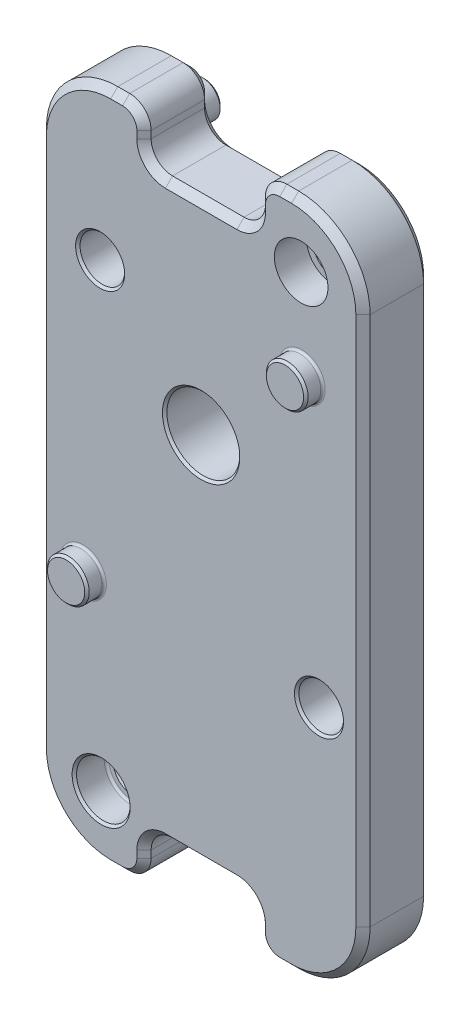
from build123d import *

# Parameters (mm, degrees)
SKETCH2_W                            = 28.7782
SKETCH2_H                            = 59.832519375
SKETCH2_R                            = 3.2385
SKETCH2_R_2                          = 1.5875
BOSS_EXTRUDE1_DEPTH                  = 6.0198
SKETCH3_R                            = 2.38125
CUT_EXTRUDE1_COUNTER_SINK_DEPTH      = 2.8448
SKETCH4_R                            = 1.5875
BOSS_EXTRUDE2_BACKPEGS_DEPTH         = 3.175
SKETCH5_R                            = 1.9812
CUT_EXTRUDE2_ENCODERSCREWHOLES_DEPTH = 42.069031354
CUT_EXTRUDE4_DEPTH                   = 2.8448
SKETCH6_R                            = 1.8542
BOSS_EXTRUDE3_ENCODERPEGS_DEPTH      = 1.524
SKETCH7_R                            = 3.96875
BOSS_EXTRUDE4_DEPTH                  = 3.175
SKETCH10_W                           = 10.16
SKETCH10_H                           = 4.445
CUT_EXTRUDE3_DEPTH                   = 41.731190846
FILLET1_0_25_R                       = 6.35
FILLET5_R                            = 1.905
FILLET4_0_075_R                      = 1.905
FILLET3_1_128_R                      = 0.1984375
CHAMFER1_0_25_SIZE                   = 0.635
CHAMFER2_1_128_SIZE                  = 0.1984375
CHAMFER3_1_64_SIZE                   = 0.396875


with BuildPart() as part:
    # Sketch2 → Boss-Extrude1 (new body)
    with BuildSketch(Plane.XY):
        with Locations((0, -7.434440313)):
            Rectangle(SKETCH2_W, SKETCH2_H)
        Circle(SKETCH2_R, mode=Mode.SUBTRACT)
        with Locations((8.89, 16.982719375)):
            Circle(SKETCH2_R_2, mode=Mode.SUBTRACT)
        with Locations((-8.89, -31.8516)):
            Circle(SKETCH2_R_2, mode=Mode.SUBTRACT)
    extrude(amount=BOSS_EXTRUDE1_DEPTH)

    # Sketch3 → Cut-Extrude1_Counter-sink (cut)
    with BuildSketch(Plane.XY.offset(6.0198)):
        with Locations((-8.89, -31.8516)):
            Circle(SKETCH3_R)
        with Locations((8.89, 16.982719375)):
            Circle(SKETCH3_R)
    extrude(amount=-CUT_EXTRUDE1_COUNTER_SINK_DEPTH, mode=Mode.SUBTRACT)

    # Sketch4 → Boss-Extrude2_BackPegs (add)
    with BuildSketch(Plane(origin=(0, 0, 0), x_dir=(-1, 0, 0), z_dir=(0, 0, -1))):
        with Locations((-8.89, -31.8516)):
            Circle(SKETCH4_R)
        with Locations((8.89, 16.982719375)):
            Circle(SKETCH4_R)
    extrude(amount=BOSS_EXTRUDE2_BACKPEGS_DEPTH)

    # Sketch5 → Cut-Extrude2_EncoderScrewHoles (cut, through all)
    with BuildSketch(Plane.XY.offset(6.0198)):
        with Locations((10.4775, -15.748)):
            Circle(SKETCH5_R)
        with Locations((-8.9789, 8.981612037)):
            Circle(SKETCH5_R)
    extrude(amount=-CUT_EXTRUDE2_ENCODERSCREWHOLES_DEPTH, mode=Mode.SUBTRACT)

    # Sketch11 → Cut-Extrude4 (cut)
    with BuildSketch(Plane(origin=(0, 0, 0), x_dir=(-1, 0, 0), z_dir=(0, 0, -1))):
        Polygon((8.9789, 5.608731765), (11.8999, 7.295171901), (11.8999, 10.668052174), (8.9789, 12.35449231), (6.0579, 10.668052174), (6.0579, 7.295171901), align=None)
        Polygon((-7.5565, -17.434440136), (-7.5565, -14.061559864), (-10.4775, -12.375119727), (-13.3985, -14.061559864), (-13.3985, -17.434440136), (-10.4775, -19.120880273), align=None)
    extrude(amount=-CUT_EXTRUDE4_DEPTH, mode=Mode.SUBTRACT)

    # Sketch6 → Boss-Extrude3_EncoderPegs (add)
    with BuildSketch(Plane.XY.offset(6.0198)):
        with Locations((-10.4775, -15.748)):
            Circle(SKETCH6_R)
        with Locations((8.9789, 8.981612037)):
            Circle(SKETCH6_R)
    extrude(amount=BOSS_EXTRUDE3_ENCODERPEGS_DEPTH)

    # Sketch7 → Boss-Extrude4 (add)
    with BuildSketch(Plane(origin=(0, 0, 0), x_dir=(-1, 0, 0), z_dir=(0, 0, -1))):
        with Locations((0, -11.9507)):
            Circle(SKETCH7_R)
    extrude(amount=BOSS_EXTRUDE4_DEPTH)

    # Sketch10 → Cut-Extrude3 (cut, through all)
    with BuildSketch(Plane(origin=(0, 0, 0), x_dir=(-1, 0, 0), z_dir=(0, 0, -1))):
        with Locations((0, 20.259319375)):
            Rectangle(SKETCH10_W, SKETCH10_H)
    cut_extrude3 = extrude(amount=-CUT_EXTRUDE3_DEPTH, mode=Mode.SUBTRACT)

    # Mirror1: Cut-Extrude3 across plane
    add(cut_extrude3.mirror(Plane(origin=(0, -7.434440312, 0), x_dir=(0, 0, 1), z_dir=(0, -1, 0))), mode=Mode.SUBTRACT)

    # Fillet1_0.25
    fillet1_0_25_edges = [part.edges().sort_by_distance(p)[0] for p in [
        (-14.3891, -37.3507, 3.0099),
        (14.3891, -37.3507, 3.0099),
        (14.3891, 22.481819375, 3.0099),
        (-14.3891, 22.481819375, 3.0099),
    ]]
    fillet(fillet1_0_25_edges, radius=FILLET1_0_25_R)

    # Fillet5
    fillet5_edges = [part.edges().sort_by_distance(p)[0] for p in [
        (-5.08, 22.481819375, 3.0099),
        (5.08, 22.481819375, 3.0099),
        (5.08, -37.3507, 3.0099),
        (-5.08, -37.3507, 3.0099),
    ]]
    fillet(fillet5_edges, radius=FILLET5_R)

    # Fillet4_0.075
    fillet4_0_075_edges = [part.edges().sort_by_distance(p)[0] for p in [
        (-5.08, 18.036819375, 3.0099),
        (5.08, 18.036819375, 3.0099),
        (-5.08, -32.9057, 3.0099),
        (5.08, -32.9057, 3.0099),
    ]]
    fillet(fillet4_0_075_edges, radius=FILLET4_0_075_R)

    # Fillet3_1/128
    fillet3_1_128_edges = [part.edges().sort_by_distance(p)[0] for p in [
        (-11.27125, -31.8516, 3.175),
        (10.4775, -31.8516, 0),
        (-7.3025, 16.982719375, 0),
        (7.1247, 8.981612037, 6.0198),
        (-12.3317, -15.748, 6.0198),
        (3.96875, -11.9507, 0),
        (13.3985, -14.061559864, 1.4224),
        (10.4775, -12.375119727, 1.4224),
        (7.5565, -14.061559864, 1.4224),
        (7.5565, -17.434440136, 1.4224),
        (10.4775, -19.120880273, 1.4224),
        (13.3985, -17.434440136, 1.4224),
        (13.3985, -15.748, 2.8448),
        (11.938, -13.218339796, 2.8448),
        (9.017, -13.218339796, 2.8448),
        (7.5565, -15.748, 2.8448),
        (9.017, -18.277660204, 2.8448),
        (11.938, -18.277660204, 2.8448),
        (-8.9789, 5.608731765, 1.4224),
        (-11.8999, 7.295171901, 1.4224),
        (-11.8999, 10.668052174, 1.4224),
        (-8.9789, 12.35449231, 1.4224),
        (-6.0579, 10.668052174, 1.4224),
        (-6.0579, 7.295171901, 1.4224),
        (-6.0579, 8.981612037, 2.8448),
        (-7.5184, 6.451951833, 2.8448),
        (-10.4394, 6.451951833, 2.8448),
        (-11.8999, 8.981612037, 2.8448),
        (-10.4394, 11.511272242, 2.8448),
        (-7.5184, 11.511272242, 2.8448),
    ]]
    fillet(fillet3_1_128_edges, radius=FILLET3_1_128_R)

    # Chamfer1_0.25
    chamfer1_0_25_edges = [part.edges().sort_by_distance(p)[0] for p in [
        (-12.529228061, -35.490828061, 6.0198),
        (-14.3891, -7.434440312, 6.0198),
        (-12.529228061, 20.621947436, 6.0198),
        (-12.529228061, -35.490828061, 0),
        (-14.3891, -7.434440312, 0),
        (-12.529228061, 20.621947436, 0),
        (-7.51205, 22.481819375, 0),
        (-7.51205, 22.481819375, 6.0198),
        (5.08, 20.259319375, 0),
        (4.522038418, 18.594780957, 0),
        (0, 18.036819375, 0),
        (-4.522038418, 18.594780957, 0),
        (-5.08, 20.259319375, 0),
        (5.08, 20.259319375, 6.0198),
        (4.522038418, 18.594780957, 6.0198),
        (0, 18.036819375, 6.0198),
        (-4.522038418, 18.594780957, 6.0198),
        (-5.08, 20.259319375, 6.0198),
        (5.637961582, 21.923857793, 0),
        (-5.637961582, 21.923857793, 0),
        (5.637961582, 21.923857793, 6.0198),
        (-5.637961582, 21.923857793, 6.0198),
    ]]
    chamfer(chamfer1_0_25_edges, length=CHAMFER1_0_25_SIZE)

    # Chamfer2_1/128
    chamfer2_1_128_edges = [part.edges().sort_by_distance(p)[0] for p in [
        (-10.4775, -31.8516, 3.175),
        (-3.2385, 0, 0),
        (-3.2385, 0, 6.0198),
        (7.3025, 16.982719375, 0),
        (-10.9601, 8.981612037, 6.0198),
        (8.4963, -15.748, 6.0198),
        (10.4775, -31.8516, -3.175),
        (-7.3025, 16.982719375, -3.175),
        (-12.3317, -15.748, 7.5438),
        (7.1247, 8.981612037, 7.5438),
        (-10.4775, -31.8516, 0),
        (-11.27125, -31.8516, 6.0198),
        (7.3025, 16.982719375, 3.175),
        (-10.9601, 8.981612037, 2.8448),
        (8.4963, -15.748, 2.8448),
        (-7.5184, 11.511272242, 0),
        (-6.084485584, 10.65270298, 0),
        (-8.9789, 12.323793922, 0),
        (-6.0579, 8.981612037, 0),
        (-10.4394, 11.511272242, 0),
        (-6.084485584, 7.310521095, 0),
        (-11.873314416, 10.65270298, 0),
        (-7.5184, 6.451951833, 0),
        (-11.8999, 8.981612037, 0),
        (-8.9789, 5.639430153, 0),
        (-11.873314416, 7.310521095, 0),
        (-10.4394, 6.451951833, 0),
        (11.938, -13.218339796, 0),
        (13.371914416, -14.076909058, 0),
        (10.4775, -12.405818115, 0),
        (13.3985, -15.748, 0),
        (9.017, -13.218339796, 0),
        (13.371914416, -17.419090942, 0),
        (7.583085584, -14.076909058, 0),
        (11.938, -18.277660204, 0),
        (7.5565, -15.748, 0),
        (10.4775, -19.090181885, 0),
        (7.583085584, -17.419090942, 0),
        (9.017, -18.277660204, 0),
    ]]
    chamfer(chamfer2_1_128_edges, length=CHAMFER2_1_128_SIZE)

    # Chamfer3_1/64
    chamfer3_1_64_edges = [part.edges().sort_by_distance(p)[0] for p in [
        (3.96875, -11.9507, -3.175),
    ]]
    chamfer(chamfer3_1_64_edges, length=CHAMFER3_1_64_SIZE)


solid = part.part
